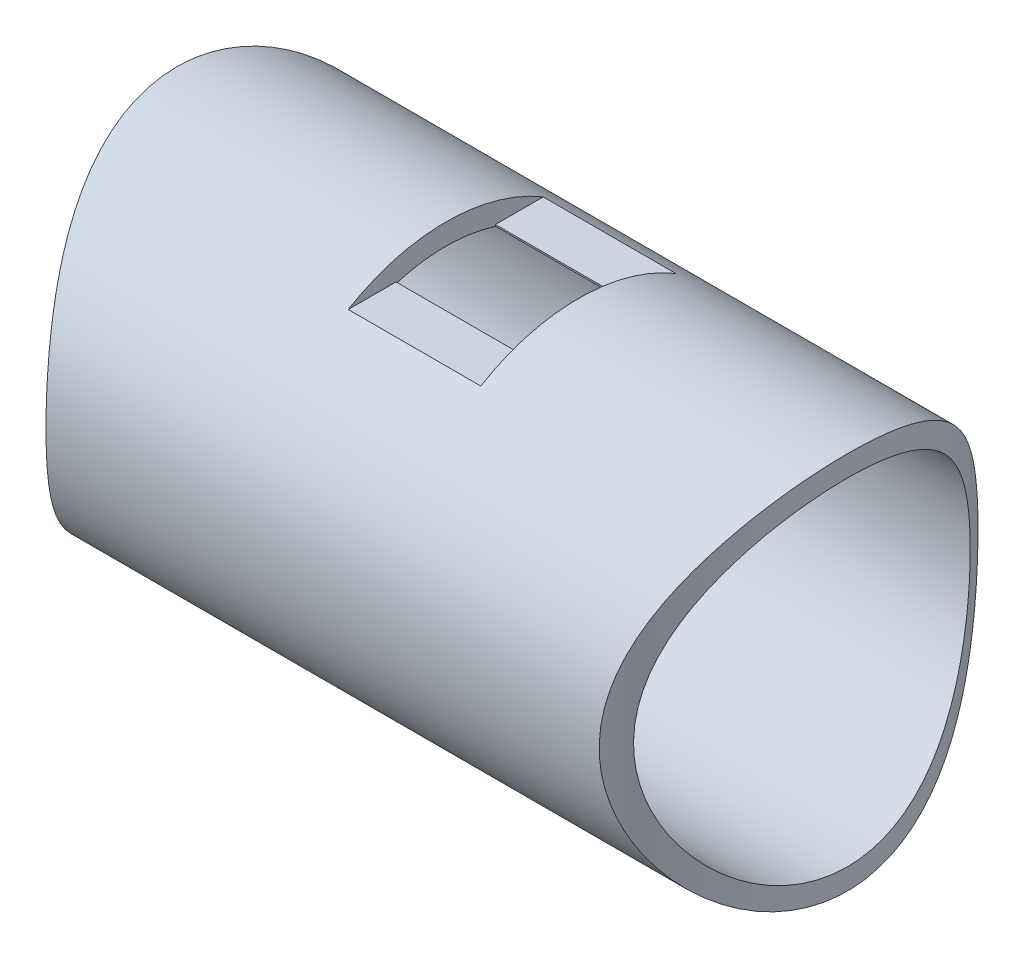
from build123d import *

# Parameters (mm, degrees)
BOSS_EXTRUDE1_DEPTH      = 101.15
BOSS_EXTRUDE1_DEPTH_BACK = 101.15
SKETCH1_R                = 57.15
SKETCH1_R_2              = 50.8
CUT_EXTRUDE3_DEPTH       = 130.474196271
CUT_EXTRUDE3_DEPTH_BACK  = 130.474196271
SKETCH3_W                = 40
SKETCH3_H                = 10
SKETCH5_W                = 40
SKETCH5_H                = 30
CUT_EXTRUDE5_DEPTH       = 18.15
CUT_EXTRUDE6_DEPTH       = 130.474196271
CUT_EXTRUDE6_DEPTH_BACK  = 130.474196271
SKETCH6_W                = 252.16572489
SKETCH6_H                = 244.887597008
SKETCH6_R                = 101.15


with BuildPart() as part:
    # Sketch1 → Boss-Extrude1 (new, two sides: drawn at the far end of the back side and taken through both)
    with BuildSketch(Plane(origin=(0, 0, 0), x_dir=(0, 0, -1), z_dir=(1, 0, 0)).offset(-BOSS_EXTRUDE1_DEPTH_BACK)):
        Circle(SKETCH1_R)
        Circle(SKETCH1_R_2, mode=Mode.SUBTRACT)
    extrude(amount=BOSS_EXTRUDE1_DEPTH + BOSS_EXTRUDE1_DEPTH_BACK)

    # Sketch3 → Cut-Extrude3 (cut, two sides: drawn at the far end of the back side and taken through both)
    with BuildSketch(Plane.XY.offset(-CUT_EXTRUDE3_DEPTH_BACK)):
        with Locations((0, 54)):
            Rectangle(SKETCH3_W, SKETCH3_H)
    extrude(amount=CUT_EXTRUDE3_DEPTH + CUT_EXTRUDE3_DEPTH_BACK, mode=Mode.SUBTRACT)

    # Sketch5 → Cut-Extrude5 (cut)
    with BuildSketch(Plane(origin=(0, 49, 0), x_dir=(1, 0, 0), z_dir=(0, 1, 0))):
        Rectangle(SKETCH5_W, SKETCH5_H)
    extrude(amount=-CUT_EXTRUDE5_DEPTH, mode=Mode.SUBTRACT)

    # Sketch6 → Cut-Extrude6 (cut, two sides: drawn at the far end of the back side and taken through both)
    with BuildSketch(Plane(origin=(0, 0, 0), x_dir=(1, 0, 0), z_dir=(0, 1, 0)).offset(-CUT_EXTRUDE6_DEPTH_BACK)):
        Rectangle(SKETCH6_W, SKETCH6_H)
        Circle(SKETCH6_R, mode=Mode.SUBTRACT)
    extrude(amount=CUT_EXTRUDE6_DEPTH + CUT_EXTRUDE6_DEPTH_BACK, mode=Mode.SUBTRACT)


solid = part.part
